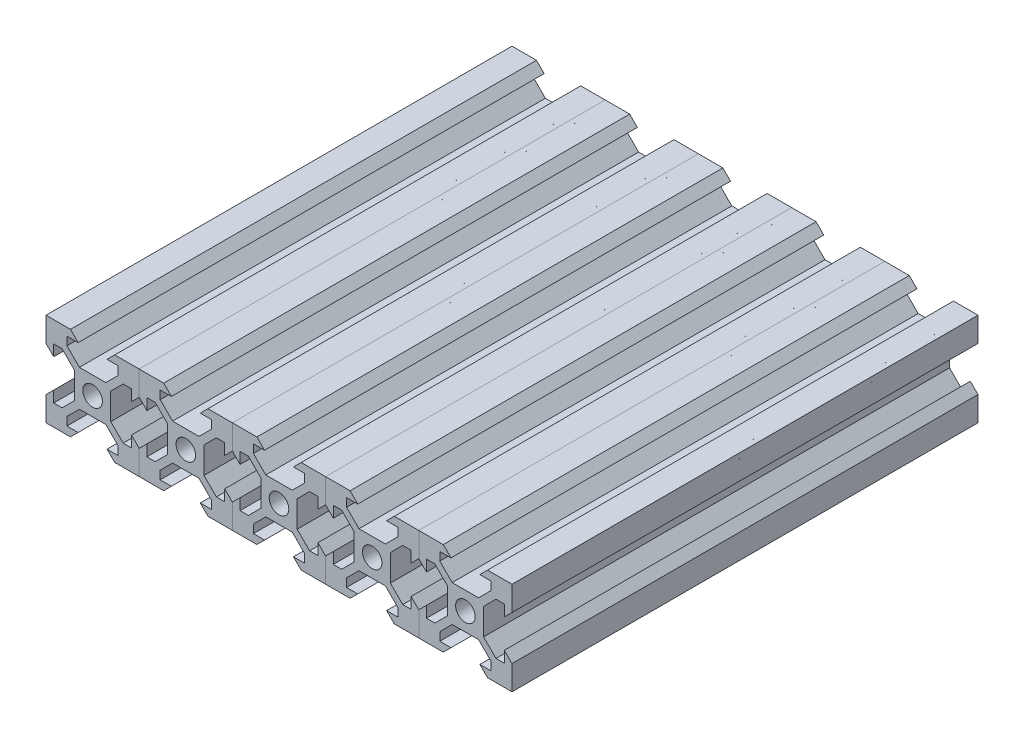
from build123d import *

# Parameters (mm, degrees)
SKETCH1_R           = 2.1
BOSS_EXTRUDE1_DEPTH = 100
MATRIZL1_COUNT      = 5
MATRIZL1_PITCH      = 20


with BuildPart() as part:
    # Sketch1 → Boss-Extrude1 (new body)
    with BuildSketch(Plane.XY):
        Polygon((2.834320347, 3.893970342), (5.5, 6.558849663), (5.5, 8.349069506), (3.1, 8.349069506), (4.75, 9.998574117), (10, 9.998574117), (10, 4.746997406), (8.35, 3.097492795), (8.350720674, 5.497492687), (6.560500912, 5.498030255), (3.894821259, 2.833150935), (3.894821259, -2.833150935), (6.560500912, -5.498030255), (8.350720674, -5.497492687), (8.35, -3.097492795), (10, -4.746997406), (10, -9.998574117), (4.75, -9.998574117), (3.1, -8.349069506), (5.5, -8.349069506), (5.5, -6.558849663), (2.834320347, -3.893970342), (-2.834320347, -3.893970342), (-5.5, -6.558849663), (-5.5, -8.349069506), (-3.1, -8.349069506), (-4.75, -9.998574117), (-10, -9.998574117), (-10, -4.746997406), (-8.35, -3.097492795), (-8.350720674, -5.497492687), (-6.560500912, -5.498030255), (-3.894821259, -2.833150935), (-3.894821259, 2.833150935), (-6.560500912, 5.498030255), (-8.350720674, 5.497492687), (-8.35, 3.097492795), (-10, 4.746997406), (-10, 9.998574117), (-4.75, 9.998574117), (-3.1, 8.349069506), (-5.5, 8.349069506), (-5.5, 6.558849663), (-2.834320347, 3.893970342), align=None)
        Circle(SKETCH1_R, mode=Mode.SUBTRACT)
    extrude(amount=BOSS_EXTRUDE1_DEPTH)


with BuildPart() as matrizl1_1:
    # MatrizL1: pattern copy
    add(part.part.moved(Location(Vector(1, 0, 0) * (1 * MATRIZL1_PITCH))))


with BuildPart() as matrizl1_2:
    # MatrizL1: pattern copy
    add(part.part.moved(Location(Vector(1, 0, 0) * (2 * MATRIZL1_PITCH))))


with BuildPart() as matrizl1_3:
    # MatrizL1: pattern copy
    add(part.part.moved(Location(Vector(1, 0, 0) * (3 * MATRIZL1_PITCH))))


with BuildPart() as matrizl1_4:
    # MatrizL1: pattern copy
    add(part.part.moved(Location(Vector(1, 0, 0) * (4 * MATRIZL1_PITCH))))


solid = Compound([part.part, matrizl1_1.part, matrizl1_2.part, matrizl1_3.part, matrizl1_4.part])
